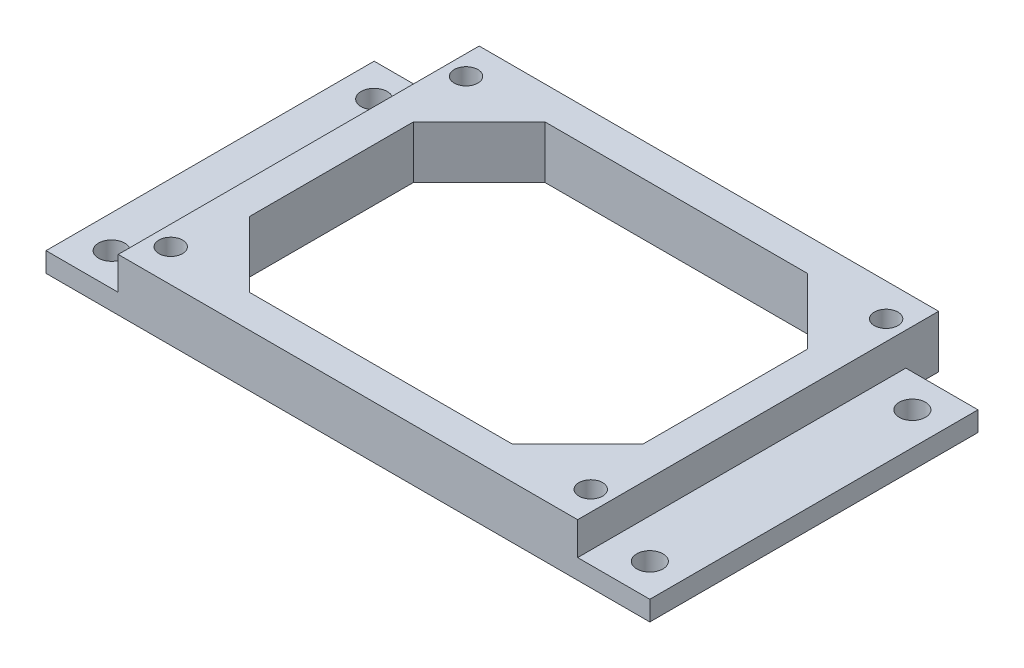
from build123d import *

# Parameters (mm, degrees)
SKETCH1_W                = 70
SKETCH1_H                = 50
BOSS_EXTRUDE1_DEPTH      = 5
SKETCH2_W                = 92
SKETCH2_H                = 50
BOSS_EXTRUDE2_DEPTH      = 3
M3_CLEARANCE_HOLE1_D     = 4
M3_CLEARANCE_HOLE1_DEPTH = 10
M3_CLEARANCE_HOLE1_TIP   = 1.201721238
SKETCH9_W                = 70
SKETCH9_H                = 8
BOSS_EXTRUDE3_DEPTH      = 5
M3_CLEARANCE_HOLE3_D     = 3.6
M3_CLEARANCE_HOLE3_DEPTH = 10
M3_CLEARANCE_HOLE3_TIP   = 1.081549114
CUT_EXTRUDE1_DEPTH       = 56.497747702


with BuildPart() as part:
    # Sketch1 → Boss-Extrude1 (new body)
    with BuildSketch(Plane(origin=(0, 0, 0), x_dir=(1, 0, 0), z_dir=(0, 1, 0))):
        Rectangle(SKETCH1_W, SKETCH1_H)
    extrude(amount=BOSS_EXTRUDE1_DEPTH)

    # Sketch2 → Boss-Extrude2 (add)
    with BuildSketch(Plane.XZ):
        Rectangle(SKETCH2_W, SKETCH2_H)
    extrude(amount=BOSS_EXTRUDE2_DEPTH)

    # M3 Clearance Hole1
    with Locations(Plane(origin=(0, 0, 0), x_dir=(1, 0, 0), z_dir=(0, 1, 0))):
        with Locations((-41, 20), (-41, -20), (41, 20), (41, -20)):
            Hole(M3_CLEARANCE_HOLE1_D / 2, depth=M3_CLEARANCE_HOLE1_DEPTH)
            with Locations((0, 0, -(M3_CLEARANCE_HOLE1_DEPTH + M3_CLEARANCE_HOLE1_TIP / 2))):  # 118° drill point
                Cone(0, M3_CLEARANCE_HOLE1_D / 2, M3_CLEARANCE_HOLE1_TIP, mode=Mode.SUBTRACT)

    # Sketch9 → Boss-Extrude3 (add)
    with BuildSketch(Plane(origin=(0, 0, -25), x_dir=(-1, 0, 0), z_dir=(0, 0, -1))):
        with Locations((0, 1)):
            Rectangle(SKETCH9_W, SKETCH9_H)
    extrude(amount=BOSS_EXTRUDE3_DEPTH)

    # M3 Clearance Hole3
    with Locations(Plane(origin=(0, 5, 0), x_dir=(1, 0, 0), z_dir=(0, 1, 0))):
        with Locations((32, -20), (-32, 25), (32, 25), (-32, -20)):
            Hole(M3_CLEARANCE_HOLE3_D / 2, depth=M3_CLEARANCE_HOLE3_DEPTH)
            with Locations((0, 0, -(M3_CLEARANCE_HOLE3_DEPTH + M3_CLEARANCE_HOLE3_TIP / 2))):  # 118° drill point
                Cone(0, M3_CLEARANCE_HOLE3_D / 2, M3_CLEARANCE_HOLE3_TIP, mode=Mode.SUBTRACT)

    # Sketch12 → Cut-Extrude1 (cut, through all)
    with BuildSketch(Plane(origin=(0, 5, 0), x_dir=(1, 0, 0), z_dir=(0, 1, 0))):
        Polygon((20, -20), (30, -10), (30, 15), (20, 25), (-20, 25), (-30, 15), (-30, -10), (-20, -20), align=None)
    extrude(amount=-CUT_EXTRUDE1_DEPTH, mode=Mode.SUBTRACT)


solid = part.part
